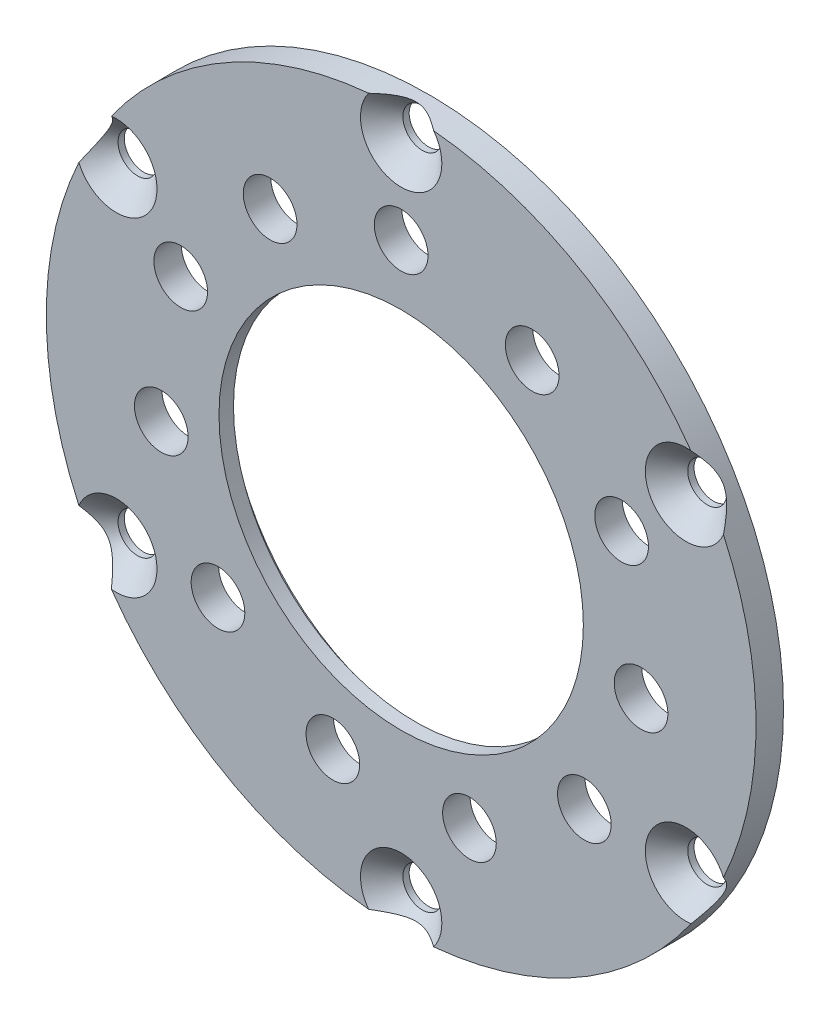
from build123d import *

# Parameters (mm, degrees)
SKETCH1_R                                    = 41
SKETCH1_R_2                                  = 21.05
BOSS_EXTRUDE1_DEPTH                          = 3.175
SKETCH2_R                                    = 23
CUT_EXTRUDE1_DEPTH                           = 1.5
CSK_FOR_M4_COUNTERSUNK_FLAT_HEAD_SCR_2_COUNT = 2
CSK_FOR_M4_COUNTERSUNK_FLAT_HEAD_SCR_2_PITCH = 38
CSK_FOR_M4_COUNTERSUNK_FLAT_HEAD_SCR_3_COUNT = 2
CSK_FOR_M4_COUNTERSUNK_FLAT_HEAD_SCR_3_PITCH = 65.817930688
CSK_FOR_M4_COUNTERSUNK_FLAT_HEAD_SCR_4_COUNT = 2
CSK_FOR_M4_COUNTERSUNK_FLAT_HEAD_SCR_4_PITCH = 76
CSK_FOR_M4_COUNTERSUNK_FLAT_HEAD_SCR_5_COUNT = 2
CSK_FOR_M4_COUNTERSUNK_FLAT_HEAD_SCR_5_PITCH = 65.817930688
CSK_FOR_M4_COUNTERSUNK_FLAT_HEAD_SCR_6_COUNT = 2
CSK_FOR_M4_COUNTERSUNK_FLAT_HEAD_SCR_6_PITCH = 38
CSK_FOR_M4_COUNTERSUNK_FLAT_HEAD_SCR_7_COUNT = 2
CSK_FOR_M4_COUNTERSUNK_FLAT_HEAD_SCR_7_PITCH = 38
SKETCH5_R                                    = 3.1
CUT_EXTRUDE2_DEPTH                           = 59.069618924


with BuildPart() as part:
    # Sketch1 → Boss-Extrude1 (new body)
    with BuildSketch(Plane(origin=(0, 0, 0), x_dir=(0, 1, 0), z_dir=(0, 0, 1))):
        with Locations(Location((0, 0, 0), (0, 0, 270))):
            Circle(SKETCH1_R)
        with Locations(Location((0, 0, 0), (0, 0, 270))):
            Circle(SKETCH1_R_2, mode=Mode.SUBTRACT)
    extrude(amount=BOSS_EXTRUDE1_DEPTH)

    # Sketch2 → Cut-Extrude1 (cut)
    with BuildSketch(Plane(origin=(0, 0, 0), x_dir=(1, 0, 0), z_dir=(0, 0, -1))):
        with Locations(Location((0, 0, 0), (0, 0, 180))):
            Circle(SKETCH2_R)
    extrude(amount=-CUT_EXTRUDE1_DEPTH, mode=Mode.SUBTRACT)

    # Sketch4 → CSK for M4 Countersunk Flat Head Screw1 (revolve, cut)
    with BuildSketch(Plane(origin=(0, 38, 3.175), x_dir=(0, -1, 0), z_dir=(1, 0, 0))):
        Polygon((0, 0), (0, 3.175), (2.25, 3.175), (2.25, 2.45), (4.7, 0), align=None)
    csk_for_m4_countersunk_flat_head_screw1 = revolve(axis=Axis((0, 38, 9.525), (0, 0, -1)), mode=Mode.SUBTRACT)

    # CSK for M4 Countersunk Flat Head Scr 2: CSK for M4 Countersunk Flat Head Screw1 ×2
    with Locations(*[Vector(0.8660254037844387, -0.49999999999999994, 0) * (i * CSK_FOR_M4_COUNTERSUNK_FLAT_HEAD_SCR_2_PITCH) for i in range(1, CSK_FOR_M4_COUNTERSUNK_FLAT_HEAD_SCR_2_COUNT)]):
        add(csk_for_m4_countersunk_flat_head_screw1, mode=Mode.SUBTRACT)

    # CSK for M4 Countersunk Flat Head Scr 3: CSK for M4 Countersunk Flat Head Screw1 ×2
    with Locations(*[Vector(0.5000000000000001, -0.8660254037844386, 0) * (i * CSK_FOR_M4_COUNTERSUNK_FLAT_HEAD_SCR_3_PITCH) for i in range(1, CSK_FOR_M4_COUNTERSUNK_FLAT_HEAD_SCR_3_COUNT)]):
        add(csk_for_m4_countersunk_flat_head_screw1, mode=Mode.SUBTRACT)

    # CSK for M4 Countersunk Flat Head Scr 4: CSK for M4 Countersunk Flat Head Screw1 ×2
    with Locations(*[(0, -i * CSK_FOR_M4_COUNTERSUNK_FLAT_HEAD_SCR_4_PITCH, 0) for i in range(1, CSK_FOR_M4_COUNTERSUNK_FLAT_HEAD_SCR_4_COUNT)]):
        add(csk_for_m4_countersunk_flat_head_screw1, mode=Mode.SUBTRACT)

    # CSK for M4 Countersunk Flat Head Scr 5: CSK for M4 Countersunk Flat Head Screw1 ×2
    with Locations(*[Vector(-0.49999999999999983, -0.8660254037844388, 0) * (i * CSK_FOR_M4_COUNTERSUNK_FLAT_HEAD_SCR_5_PITCH) for i in range(1, CSK_FOR_M4_COUNTERSUNK_FLAT_HEAD_SCR_5_COUNT)]):
        add(csk_for_m4_countersunk_flat_head_screw1, mode=Mode.SUBTRACT)

    # CSK for M4 Countersunk Flat Head Scr 6: CSK for M4 Countersunk Flat Head Screw1 ×2
    with Locations(*[Vector(-0.8660254037844387, -0.4999999999999999, 0) * (i * CSK_FOR_M4_COUNTERSUNK_FLAT_HEAD_SCR_6_PITCH) for i in range(1, CSK_FOR_M4_COUNTERSUNK_FLAT_HEAD_SCR_6_COUNT)]):
        add(csk_for_m4_countersunk_flat_head_screw1, mode=Mode.SUBTRACT)

    # CSK for M4 Countersunk Flat Head Scr 7: CSK for M4 Countersunk Flat Head Screw1 ×2
    with Locations(*[(0, -i * CSK_FOR_M4_COUNTERSUNK_FLAT_HEAD_SCR_7_PITCH, 0) for i in range(1, CSK_FOR_M4_COUNTERSUNK_FLAT_HEAD_SCR_7_COUNT)]):
        add(csk_for_m4_countersunk_flat_head_screw1, mode=Mode.SUBTRACT)

    # Sketch5 → Cut-Extrude2 (cut, through all)
    with BuildSketch(Plane.XY.offset(3.175)):
        with Locations((-27.715000373, -3.984815472)):
            Circle(SKETCH5_R)
        with Locations((-21.160988082, -18.33610055)):
            Circle(SKETCH5_R)
        with Locations((-7.888511592, -26.865803261)):
            Circle(SKETCH5_R)
        with Locations((7.888511592, -26.865803261)):
            Circle(SKETCH5_R)
        with Locations((21.160988082, -18.33610055)):
            Circle(SKETCH5_R)
        with Locations((27.715000373, -3.984815472)):
            Circle(SKETCH5_R)
        with Locations((25.46969587, 11.631620364)):
            Circle(SKETCH5_R)
        with Locations((15.137942889, 23.555098919)):
            Circle(SKETCH5_R)
        with Locations((0, 28)):
            Circle(SKETCH5_R)
        with Locations((-15.137942889, 23.555098919)):
            Circle(SKETCH5_R)
        with Locations((-25.46969587, 11.631620364)):
            Circle(SKETCH5_R)
    extrude(amount=-CUT_EXTRUDE2_DEPTH, mode=Mode.SUBTRACT)


solid = part.part
